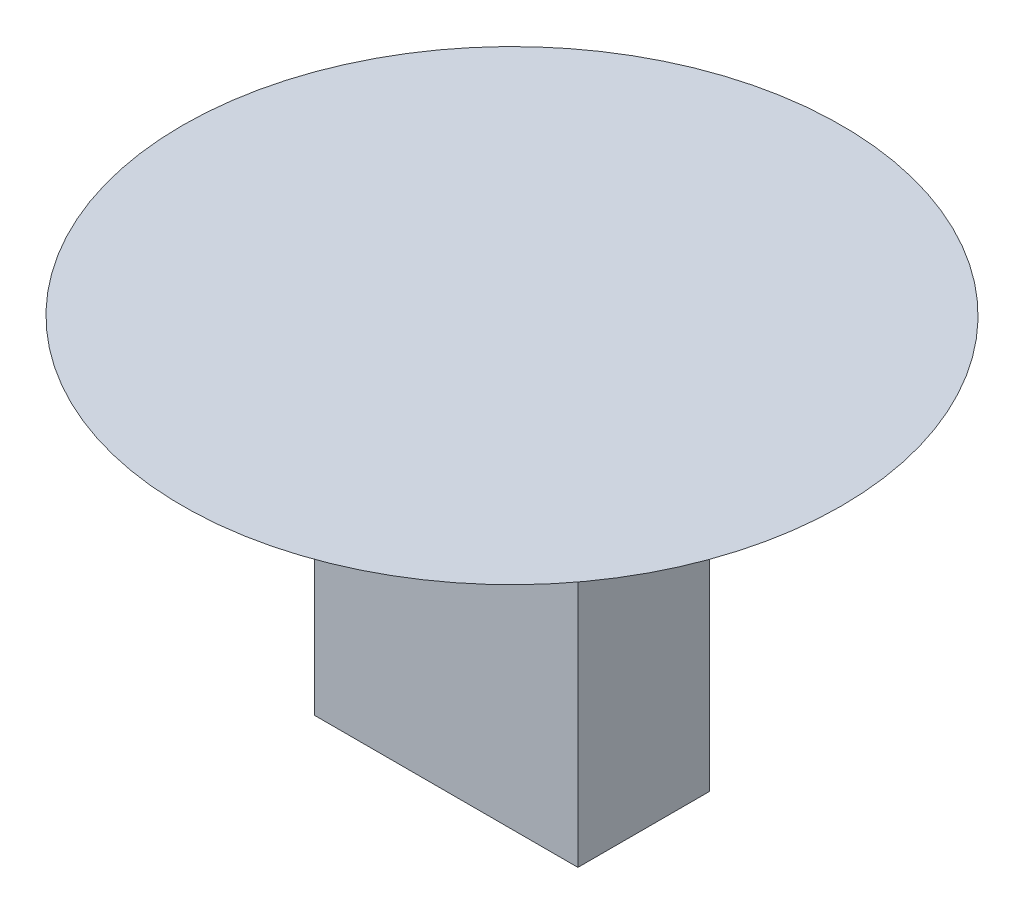
from build123d import *

# Parameters (mm, degrees)
SKETCH_1_W      = 160
SKETCH_1_H      = 80
EXTRUDE_1_DEPTH = 200


with BuildPart() as part:
    # 草图1 → 凸台-拉伸1 (new body)
    with BuildSketch(Plane(origin=(0, 0, 0), x_dir=(1, 0, 0), z_dir=(0, 1, 0))):
        Rectangle(SKETCH_1_W, SKETCH_1_H)
    extrude(amount=EXTRUDE_1_DEPTH)

    # 草图2 → 旋转1 (revolve)
    with BuildSketch(Plane.XY):
        Polygon((0, 230), (-200, 230), (-80, 200), (0, 200), align=None)
    revolve(axis=Axis((0, 242.596859874, 0), (0, -1, 0)))


solid = part.part
